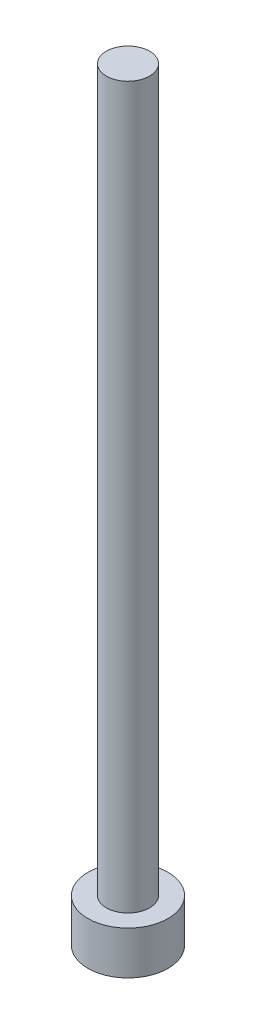
from build123d import *

# Parameters (mm, degrees)
SKETCH1_R           = 2.78
BOSS_EXTRUDE1_DEPTH = 3
SKETCH2_R           = 1.5
BOSS_EXTRUDE2_DEPTH = 50


with BuildPart() as part:
    # Sketch1 → Boss-Extrude1 (new body)
    with BuildSketch(Plane(origin=(0, 0, 0), x_dir=(1, 0, 0), z_dir=(0, 1, 0))):
        with Locations(Location((0, 0, 0), (0, 0, 270))):
            Circle(SKETCH1_R)
    extrude(amount=BOSS_EXTRUDE1_DEPTH)

    # Sketch2 → Boss-Extrude2 (add)
    with BuildSketch(Plane(origin=(0, 3, 0), x_dir=(1, 0, 0), z_dir=(0, 1, 0))):
        with Locations(Location((0, 0, 0), (0, 0, 270))):
            Circle(SKETCH2_R)
    extrude(amount=BOSS_EXTRUDE2_DEPTH)


solid = part.part
